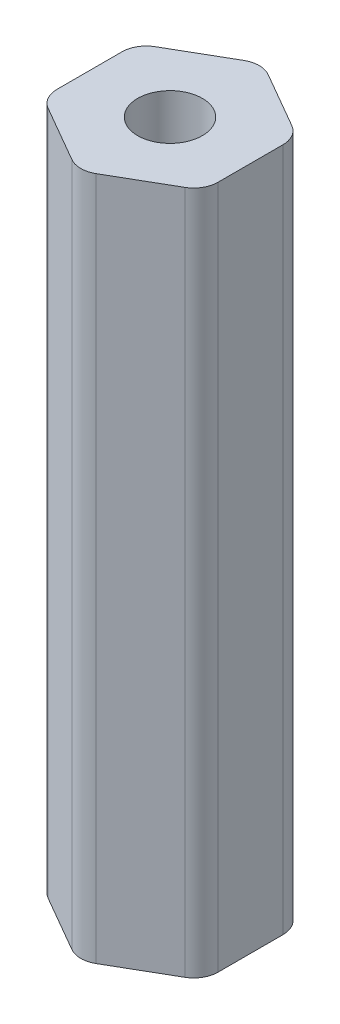
from build123d import *

# Parameters (mm, degrees)
SKETCH1_R           = 2.5527
BOSS_EXTRUDE1_DEPTH = 53.975
FILLET1_R           = 1.905


with BuildPart() as part:
    # Sketch1 → Boss-Extrude1 (new body)
    with BuildSketch(Plane(origin=(0, 0, 0), x_dir=(1, 0, 0), z_dir=(0, 1, 0))):
        Polygon((0, 7.332348419), (-6.35, 3.666174209), (-6.35, -3.666174209), (0, -7.332348419), (6.35, -3.666174209), (6.35, 3.666174209), align=None)
        with Locations(Location((0, 0, 0), (0, 0, 270))):
            Circle(SKETCH1_R, mode=Mode.SUBTRACT)
    extrude(amount=BOSS_EXTRUDE1_DEPTH)

    # Fillet1
    fillet1_edges = [part.edges().sort_by_distance(p)[0] for p in [
        (6.35, 26.9875, -3.666174209),
        (6.35, 26.9875, 3.666174209),
        (0, 26.9875, 7.332348419),
        (-6.35, 26.9875, 3.666174209),
        (-6.35, 26.9875, -3.666174209),
        (0, 26.9875, -7.332348419),
    ]]
    fillet(fillet1_edges, radius=FILLET1_R)


solid = part.part
